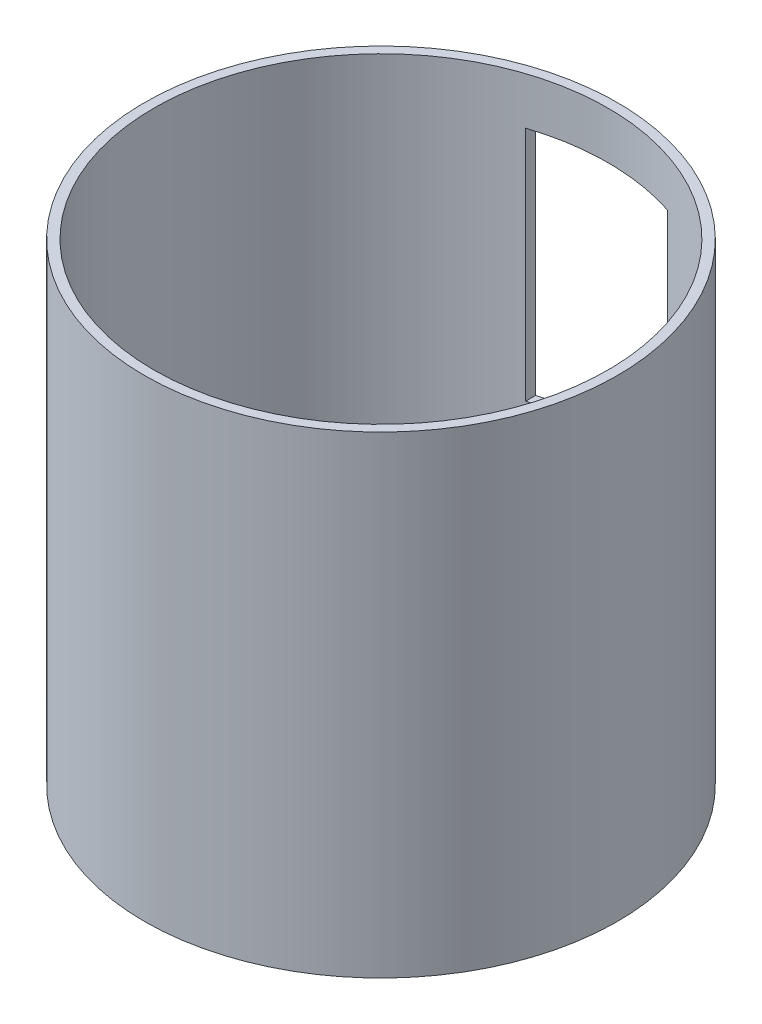
from build123d import *

# Parameters (mm, degrees)
SKETCH1_R           = 2500
BOSS_EXTRUDE1_DEPTH = 5000
SKETCH2_R           = 2000
CUT_EXTRUDE1_DEPTH  = 500
SKETCH3_R           = 2400
CUT_EXTRUDE2_DEPTH  = 4420
SKETCH4_W           = 1500
SKETCH4_H           = 2500
CUT_EXTRUDE3_DEPTH  = 4420


with BuildPart() as part:
    # Sketch1 → Boss-Extrude1 (new body)
    with BuildSketch(Plane(origin=(0, 0, 0), x_dir=(1, 0, 0), z_dir=(0, 1, 0))):
        with Locations(Location((0, 0, 0), (0, 0, 270))):
            Circle(SKETCH1_R)
    extrude(amount=BOSS_EXTRUDE1_DEPTH)

    # Sketch2 → Cut-Extrude1 (cut)
    with BuildSketch(Plane.XZ):
        with Locations(Location((0, 0, 0), (0, 0, 270))):
            Circle(SKETCH2_R)
    extrude(amount=-CUT_EXTRUDE1_DEPTH, mode=Mode.SUBTRACT)

    # Sketch3 → Cut-Extrude2 (cut)
    with BuildSketch(Plane(origin=(0, 5000, 0), x_dir=(1, 0, 0), z_dir=(0, 1, 0))):
        with Locations(Location((0, 0, 0), (0, 0, 270))):
            Circle(SKETCH3_R)
    extrude(amount=-CUT_EXTRUDE2_DEPTH, mode=Mode.SUBTRACT)

    # Sketch4 → Cut-Extrude3 (cut)
    with BuildSketch(Plane.XY):
        with Locations((0, 3250)):
            Rectangle(SKETCH4_W, SKETCH4_H)
    extrude(amount=-CUT_EXTRUDE3_DEPTH, mode=Mode.SUBTRACT)


solid = part.part
